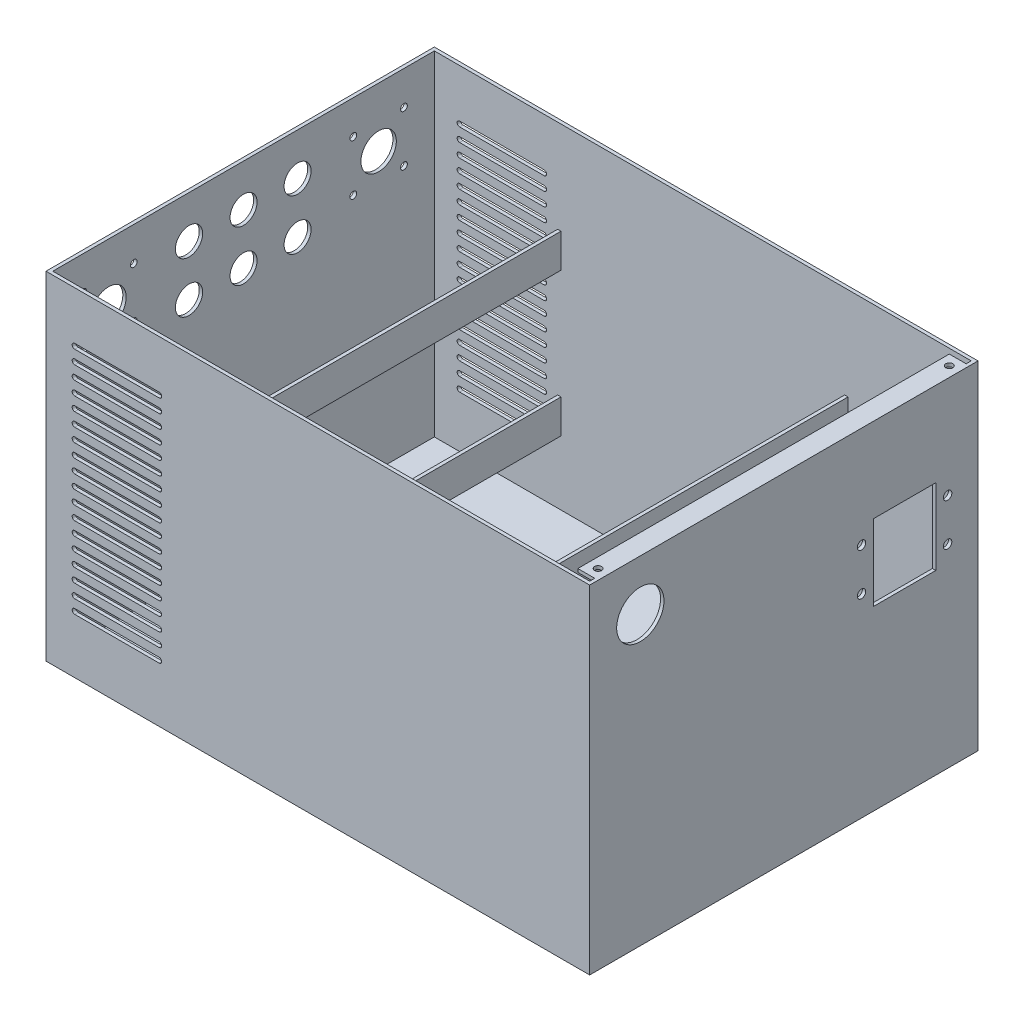
from build123d import *

# Parameters (mm, degrees)
SKETCH_2_W           = 320
SKETCH_2_H           = 230
EXTRUDE_1_DEPTH      = 200
SKETCH_3_W           = 318
SKETCH_3_H           = 226
CUT_EXTRUDE_2_DEPTH  = 200
SKETCH_4_W           = 10
SKETCH_4_H           = 220
EXTRUDE_2_DEPTH      = 2
SKETCH_5_R           = 2.1
CUT_EXTRUDE_3_DEPTH  = 2
SKETCH_6_R           = 2.1
CUT_EXTRUDE_4_DEPTH  = 2
CUT_EXTRUDE_10_DEPTH = 2
CUT_EXTRUDE_START    = -2
CUT_EXTRUDE_11_DEPTH = 2
SKETCH_15_R          = 14
CUT_EXTRUDE_12_DEPTH = 2
SKETCH_19_W          = 320
SKETCH_19_H          = 230
EXTRUDE_7_DEPTH      = 2
SKETCH_20_W          = 230
SKETCH_20_H          = 200
EXTRUDE_8_DEPTH      = 2
SKETCH_23_W          = 2
SKETCH_23_H          = 20
EXTRUDE_11_DEPTH     = 230
SKETCH_24_W          = 2
SKETCH_24_H          = 20
EXTRUDE_12_DEPTH     = 230
SKETCH_25_W          = 2
SKETCH_25_H          = 20
EXTRUDE_13_DEPTH     = 230
SKETCH_26_W          = 2
SKETCH_26_H          = 20
EXTRUDE_14_DEPTH     = 230
SKETCH_31_R          = 2
CUT_EXTRUDE_21_DEPTH = 2
SKETCH_32_R          = 10.5
CUT_EXTRUDE_22_DEPTH = 2
SKETCH_35_R          = 8
SKETCH_35_R_2        = 8.073696944
CUT_EXTRUDE_23_DEPTH = 2
SKETCH_36_W          = 37
SKETCH_36_H          = 45
CUT_EXTRUDE_24_DEPTH = 2
SKETCH_37_R          = 2.5
CUT_EXTRUDE_25_DEPTH = 2


with BuildPart() as part:
    # 草图2 → 凸台-拉伸1 (new body)
    with BuildSketch(Plane(origin=(0, 0, 0), x_dir=(1, 0, 0), z_dir=(0, 1, 0))):
        Rectangle(SKETCH_2_W, SKETCH_2_H)
    extrude(amount=EXTRUDE_1_DEPTH)

    # 草图3 → 切除-拉伸2 (cut)
    with BuildSketch(Plane(origin=(0, 200, 0), x_dir=(1, 0, 0), z_dir=(0, 1, 0))):
        with Locations((-1, 0)):
            Rectangle(SKETCH_3_W, SKETCH_3_H)
    extrude(amount=-CUT_EXTRUDE_2_DEPTH, mode=Mode.SUBTRACT)

    # 草图4 → 凸台-拉伸2 (add)
    with BuildSketch(Plane(origin=(0, 200, 0), x_dir=(1, 0, 0), z_dir=(0, 1, 0))):
        with Locations((153, 0)):
            Rectangle(SKETCH_4_W, SKETCH_4_H)
    extrude(amount=-EXTRUDE_2_DEPTH)

    # 草图5 → 切除-拉伸3 (cut)
    with BuildSketch(Plane(origin=(0, 200, 0), x_dir=(1, 0, 0), z_dir=(0, 1, 0))):
        with Locations(Location((154, 104, 0), (0, 0, 270))):
            Circle(SKETCH_5_R)
    extrude(amount=-CUT_EXTRUDE_3_DEPTH, mode=Mode.SUBTRACT)

    # 草图6 → 切除-拉伸4 (cut)
    with BuildSketch(Plane(origin=(0, 200, 0), x_dir=(1, 0, 0), z_dir=(0, 1, 0))):
        with Locations(Location((154, -104, 0), (0, 0, 270))):
            Circle(SKETCH_6_R)
    extrude(amount=-CUT_EXTRUDE_4_DEPTH, mode=Mode.SUBTRACT)

    # 草图13 → 切除-拉伸10 (cut)
    with BuildSketch(Plane.XY.offset(115)):
        with BuildLine():
            Line((-145, 171.5), (-95, 171.5))
            ThreePointArc((-95, 171.5), (-93.5, 170), (-95, 168.5))
            Line((-95, 168.5), (-145, 168.5))
            ThreePointArc((-145, 168.5), (-146.5, 170), (-145, 171.5))
        make_face()
        with BuildLine():
            Line((-145, 163.5), (-95, 163.5))
            ThreePointArc((-95, 163.5), (-93.5, 162), (-95, 160.5))
            Line((-95, 160.5), (-145, 160.5))
            ThreePointArc((-145, 160.5), (-146.5, 162), (-145, 163.5))
        make_face()
        with BuildLine():
            Line((-145, 155.5), (-95, 155.5))
            ThreePointArc((-95, 155.5), (-93.5, 154), (-95, 152.5))
            Line((-95, 152.5), (-145, 152.5))
            ThreePointArc((-145, 152.5), (-146.5, 154), (-145, 155.5))
        make_face()
        with BuildLine():
            Line((-145, 147.5), (-95, 147.5))
            ThreePointArc((-95, 147.5), (-93.5, 146), (-95, 144.5))
            Line((-95, 144.5), (-145, 144.5))
            ThreePointArc((-145, 144.5), (-146.5, 146), (-145, 147.5))
        make_face()
        with BuildLine():
            Line((-145, 139.5), (-95, 139.5))
            ThreePointArc((-95, 139.5), (-93.5, 138), (-95, 136.5))
            Line((-95, 136.5), (-145, 136.5))
            ThreePointArc((-145, 136.5), (-146.5, 138), (-145, 139.5))
        make_face()
        with BuildLine():
            Line((-145, 131.5), (-95, 131.5))
            ThreePointArc((-95, 131.5), (-93.5, 130), (-95, 128.5))
            Line((-95, 128.5), (-145, 128.5))
            ThreePointArc((-145, 128.5), (-146.5, 130), (-145, 131.5))
        make_face()
        with BuildLine():
            Line((-145, 123.5), (-95, 123.5))
            ThreePointArc((-95, 123.5), (-93.5, 122), (-95, 120.5))
            Line((-95, 120.5), (-145, 120.5))
            ThreePointArc((-145, 120.5), (-146.5, 122), (-145, 123.5))
        make_face()
        with BuildLine():
            Line((-145, 115.5), (-95, 115.5))
            ThreePointArc((-95, 115.5), (-93.5, 114), (-95, 112.5))
            Line((-95, 112.5), (-145, 112.5))
            ThreePointArc((-145, 112.5), (-146.5, 114), (-145, 115.5))
        make_face()
        with BuildLine():
            Line((-145, 107.5), (-95, 107.5))
            ThreePointArc((-95, 107.5), (-93.5, 106), (-95, 104.5))
            Line((-95, 104.5), (-145, 104.5))
            ThreePointArc((-145, 104.5), (-146.5, 106), (-145, 107.5))
        make_face()
        with BuildLine():
            Line((-145, 99.5), (-95, 99.5))
            ThreePointArc((-95, 99.5), (-93.5, 98), (-95, 96.5))
            Line((-95, 96.5), (-145, 96.5))
            ThreePointArc((-145, 96.5), (-146.5, 98), (-145, 99.5))
        make_face()
        with BuildLine():
            Line((-145, 91.5), (-95, 91.5))
            ThreePointArc((-95, 91.5), (-93.5, 90), (-95, 88.5))
            Line((-95, 88.5), (-145, 88.5))
            ThreePointArc((-145, 88.5), (-146.5, 90), (-145, 91.5))
        make_face()
        with BuildLine():
            Line((-145, 83.5), (-95, 83.5))
            ThreePointArc((-95, 83.5), (-93.5, 82), (-95, 80.5))
            Line((-95, 80.5), (-145, 80.5))
            ThreePointArc((-145, 80.5), (-146.5, 82), (-145, 83.5))
        make_face()
        with BuildLine():
            Line((-145, 75.5), (-95, 75.5))
            ThreePointArc((-95, 75.5), (-93.5, 74), (-95, 72.5))
            Line((-95, 72.5), (-145, 72.5))
            ThreePointArc((-145, 72.5), (-146.5, 74), (-145, 75.5))
        make_face()
        with BuildLine():
            Line((-145, 67.5), (-95, 67.5))
            ThreePointArc((-95, 67.5), (-93.5, 66), (-95, 64.5))
            Line((-95, 64.5), (-145, 64.5))
            ThreePointArc((-145, 64.5), (-146.5, 66), (-145, 67.5))
        make_face()
        with BuildLine():
            Line((-145, 59.5), (-95, 59.5))
            ThreePointArc((-95, 59.5), (-93.5, 58), (-95, 56.5))
            Line((-95, 56.5), (-145, 56.5))
            ThreePointArc((-145, 56.5), (-146.5, 58), (-145, 59.5))
        make_face()
        with BuildLine():
            Line((-145, 51.5), (-95, 51.5))
            ThreePointArc((-95, 51.5), (-93.5, 50), (-95, 48.5))
            Line((-95, 48.5), (-145, 48.5))
            ThreePointArc((-145, 48.5), (-146.5, 50), (-145, 51.5))
        make_face()
        with BuildLine():
            Line((-145, 43.5), (-95, 43.5))
            ThreePointArc((-95, 43.5), (-93.5, 42), (-95, 40.5))
            Line((-95, 40.5), (-145, 40.5))
            ThreePointArc((-145, 40.5), (-146.5, 42), (-145, 43.5))
        make_face()
        with BuildLine():
            Line((-145, 35.5), (-95, 35.5))
            ThreePointArc((-95, 35.5), (-93.5, 34), (-95, 32.5))
            Line((-95, 32.5), (-145, 32.5))
            ThreePointArc((-145, 32.5), (-146.5, 34), (-145, 35.5))
        make_face()
    extrude(amount=-CUT_EXTRUDE_10_DEPTH, mode=Mode.SUBTRACT)

    # 草图14 → 切除-拉伸11 (cut)
    with BuildSketch(Plane(origin=(0, 0, -115), x_dir=(-1, 0, 0), z_dir=(0, 0, -1)).offset(CUT_EXTRUDE_START)):
        with BuildLine():
            Line((145, 168.5), (95, 168.5))
            ThreePointArc((95, 168.5), (93.5, 170), (95, 171.5))
            Line((95, 171.5), (145, 171.5))
            ThreePointArc((145, 171.5), (146.5, 170), (145, 168.5))
        make_face()
        with BuildLine():
            Line((145, 160.5), (95, 160.5))
            ThreePointArc((95, 160.5), (93.5, 162), (95, 163.5))
            Line((95, 163.5), (145, 163.5))
            ThreePointArc((145, 163.5), (146.5, 162), (145, 160.5))
        make_face()
        with BuildLine():
            Line((145, 152.5), (95, 152.5))
            ThreePointArc((95, 152.5), (93.5, 154), (95, 155.5))
            Line((95, 155.5), (145, 155.5))
            ThreePointArc((145, 155.5), (146.5, 154), (145, 152.5))
        make_face()
        with BuildLine():
            Line((145, 144.5), (95, 144.5))
            ThreePointArc((95, 144.5), (93.5, 146), (95, 147.5))
            Line((95, 147.5), (145, 147.5))
            ThreePointArc((145, 147.5), (146.5, 146), (145, 144.5))
        make_face()
        with BuildLine():
            Line((145, 136.5), (95, 136.5))
            ThreePointArc((95, 136.5), (93.5, 138), (95, 139.5))
            Line((95, 139.5), (145, 139.5))
            ThreePointArc((145, 139.5), (146.5, 138), (145, 136.5))
        make_face()
        with BuildLine():
            Line((145, 128.5), (95, 128.5))
            ThreePointArc((95, 128.5), (93.5, 130), (95, 131.5))
            Line((95, 131.5), (145, 131.5))
            ThreePointArc((145, 131.5), (146.5, 130), (145, 128.5))
        make_face()
        with BuildLine():
            Line((145, 120.5), (95, 120.5))
            ThreePointArc((95, 120.5), (93.5, 122), (95, 123.5))
            Line((95, 123.5), (145, 123.5))
            ThreePointArc((145, 123.5), (146.5, 122), (145, 120.5))
        make_face()
        with BuildLine():
            Line((145, 112.5), (95, 112.5))
            ThreePointArc((95, 112.5), (93.5, 114), (95, 115.5))
            Line((95, 115.5), (145, 115.5))
            ThreePointArc((145, 115.5), (146.5, 114), (145, 112.5))
        make_face()
        with BuildLine():
            Line((145, 104.5), (95, 104.5))
            ThreePointArc((95, 104.5), (93.5, 106), (95, 107.5))
            Line((95, 107.5), (145, 107.5))
            ThreePointArc((145, 107.5), (146.5, 106), (145, 104.5))
        make_face()
        with BuildLine():
            Line((145, 96.5), (95, 96.5))
            ThreePointArc((95, 96.5), (93.5, 98), (95, 99.5))
            Line((95, 99.5), (145, 99.5))
            ThreePointArc((145, 99.5), (146.5, 98), (145, 96.5))
        make_face()
        with BuildLine():
            Line((145, 88.5), (95, 88.5))
            ThreePointArc((95, 88.5), (93.5, 90), (95, 91.5))
            Line((95, 91.5), (145, 91.5))
            ThreePointArc((145, 91.5), (146.5, 90), (145, 88.5))
        make_face()
        with BuildLine():
            Line((145, 80.5), (95, 80.5))
            ThreePointArc((95, 80.5), (93.5, 82), (95, 83.5))
            Line((95, 83.5), (145, 83.5))
            ThreePointArc((145, 83.5), (146.5, 82), (145, 80.5))
        make_face()
        with BuildLine():
            Line((145, 72.5), (95, 72.5))
            ThreePointArc((95, 72.5), (93.5, 74), (95, 75.5))
            Line((95, 75.5), (145, 75.5))
            ThreePointArc((145, 75.5), (146.5, 74), (145, 72.5))
        make_face()
        with BuildLine():
            Line((145, 64.5), (95, 64.5))
            ThreePointArc((95, 64.5), (93.5, 66), (95, 67.5))
            Line((95, 67.5), (145, 67.5))
            ThreePointArc((145, 67.5), (146.5, 66), (145, 64.5))
        make_face()
        with BuildLine():
            Line((145, 56.5), (95, 56.5))
            ThreePointArc((95, 56.5), (93.5, 58), (95, 59.5))
            Line((95, 59.5), (145, 59.5))
            ThreePointArc((145, 59.5), (146.5, 58), (145, 56.5))
        make_face()
        with BuildLine():
            Line((145, 48.5), (95, 48.5))
            ThreePointArc((95, 48.5), (93.5, 50), (95, 51.5))
            Line((95, 51.5), (145, 51.5))
            ThreePointArc((145, 51.5), (146.5, 50), (145, 48.5))
        make_face()
        with BuildLine():
            Line((145, 40.5), (95, 40.5))
            ThreePointArc((95, 40.5), (93.5, 42), (95, 43.5))
            Line((95, 43.5), (145, 43.5))
            ThreePointArc((145, 43.5), (146.5, 42), (145, 40.5))
        make_face()
        with BuildLine():
            Line((145, 32.5), (95, 32.5))
            ThreePointArc((95, 32.5), (93.5, 34), (95, 35.5))
            Line((95, 35.5), (145, 35.5))
            ThreePointArc((145, 35.5), (146.5, 34), (145, 32.5))
        make_face()
    extrude(amount=CUT_EXTRUDE_11_DEPTH, mode=Mode.SUBTRACT)

    # 草图15 → 切除-拉伸12 (cut)
    with BuildSketch(Plane(origin=(160, 0, 0), x_dir=(0, 0, -1), z_dir=(1, 0, 0))):
        with Locations((-85, 170)):
            Circle(SKETCH_15_R)
    extrude(amount=-CUT_EXTRUDE_12_DEPTH, mode=Mode.SUBTRACT)

    # 草图19 → 凸台-拉伸7 (add)
    with BuildSketch(Plane.XZ):
        Rectangle(SKETCH_19_W, SKETCH_19_H)
    extrude(amount=-EXTRUDE_7_DEPTH)

    # 草图20 → 凸台-拉伸8 (add)
    with BuildSketch(Plane.ZY.offset(160)):
        with Locations((0, 100)):
            Rectangle(SKETCH_20_W, SKETCH_20_H)
    extrude(amount=EXTRUDE_8_DEPTH)

    # 草图23 → 凸台-拉伸11 (add)
    with BuildSketch(Plane.XY.offset(115)):
        with Locations((84, 50)):
            Rectangle(SKETCH_23_W, SKETCH_23_H)
    extrude(amount=-EXTRUDE_11_DEPTH)

    # 草图24 → 凸台-拉伸12 (add)
    with BuildSketch(Plane.XY.offset(115)):
        with Locations((-86, 50)):
            Rectangle(SKETCH_24_W, SKETCH_24_H)
    extrude(amount=-EXTRUDE_12_DEPTH)

    # 草图25 → 凸台-拉伸13 (add)
    with BuildSketch(Plane.XY.offset(115)):
        with Locations((84, 135)):
            Rectangle(SKETCH_25_W, SKETCH_25_H)
    extrude(amount=-EXTRUDE_13_DEPTH)

    # 草图26 → 凸台-拉伸14 (add)
    with BuildSketch(Plane.XY.offset(115)):
        with Locations((-86, 135)):
            Rectangle(SKETCH_26_W, SKETCH_26_H)
    extrude(amount=-EXTRUDE_14_DEPTH)

    # 草图31 → 切除-拉伸21 (cut)
    with BuildSketch(Plane.ZY.offset(162)):
        with Locations((95, 180)):
            Circle(SKETCH_31_R)
        with Locations((65, 180)):
            Circle(SKETCH_31_R)
        with Locations((65, 150)):
            Circle(SKETCH_31_R)
        with Locations((95, 150)):
            Circle(SKETCH_31_R)
        with Locations((-95, 180)):
            Circle(SKETCH_31_R)
        with Locations((-95, 150)):
            Circle(SKETCH_31_R)
        with Locations((-65, 150)):
            Circle(SKETCH_31_R)
        with Locations((-65, 180)):
            Circle(SKETCH_31_R)
    extrude(amount=-CUT_EXTRUDE_21_DEPTH, mode=Mode.SUBTRACT)

    # 草图32 → 切除-拉伸22 (cut)
    with BuildSketch(Plane.ZY.offset(162)):
        with Locations((80, 165)):
            Circle(SKETCH_32_R)
        with Locations((-80, 165)):
            Circle(SKETCH_32_R)
    extrude(amount=-CUT_EXTRUDE_22_DEPTH, mode=Mode.SUBTRACT)

    # 草图35 → 切除-拉伸23 (cut)
    with BuildSketch(Plane.ZY.offset(162)):
        with Locations((0, 175)):
            Circle(SKETCH_35_R)
        with Locations((32.294787775, 175)):
            Circle(SKETCH_35_R_2)
        with Locations((-32.006441456, 175)):
            Circle(SKETCH_35_R)
        with Locations((0, 145)):
            Circle(SKETCH_35_R)
        with Locations((-32.006441456, 145)):
            Circle(SKETCH_35_R)
        with Locations((32.294787775, 145)):
            Circle(SKETCH_35_R_2)
    extrude(amount=-CUT_EXTRUDE_23_DEPTH, mode=Mode.SUBTRACT)

    # 草图36 → 切除-拉伸24 (cut)
    with BuildSketch(Plane(origin=(160, 0, 0), x_dir=(0, 0, -1), z_dir=(1, 0, 0))):
        with Locations((71.5, 127.5)):
            Rectangle(SKETCH_36_W, SKETCH_36_H)
    extrude(amount=-CUT_EXTRUDE_24_DEPTH, mode=Mode.SUBTRACT)

    # 草图37 → 切除-拉伸25 (cut)
    with BuildSketch(Plane(origin=(160, 0, 0), x_dir=(0, 0, -1), z_dir=(1, 0, 0))):
        with Locations((46, 140)):
            Circle(SKETCH_37_R)
        with Locations((97, 140)):
            Circle(SKETCH_37_R)
        with Locations((97, 115)):
            Circle(SKETCH_37_R)
        with Locations((46, 115)):
            Circle(SKETCH_37_R)
    extrude(amount=-CUT_EXTRUDE_25_DEPTH, mode=Mode.SUBTRACT)


solid = part.part
